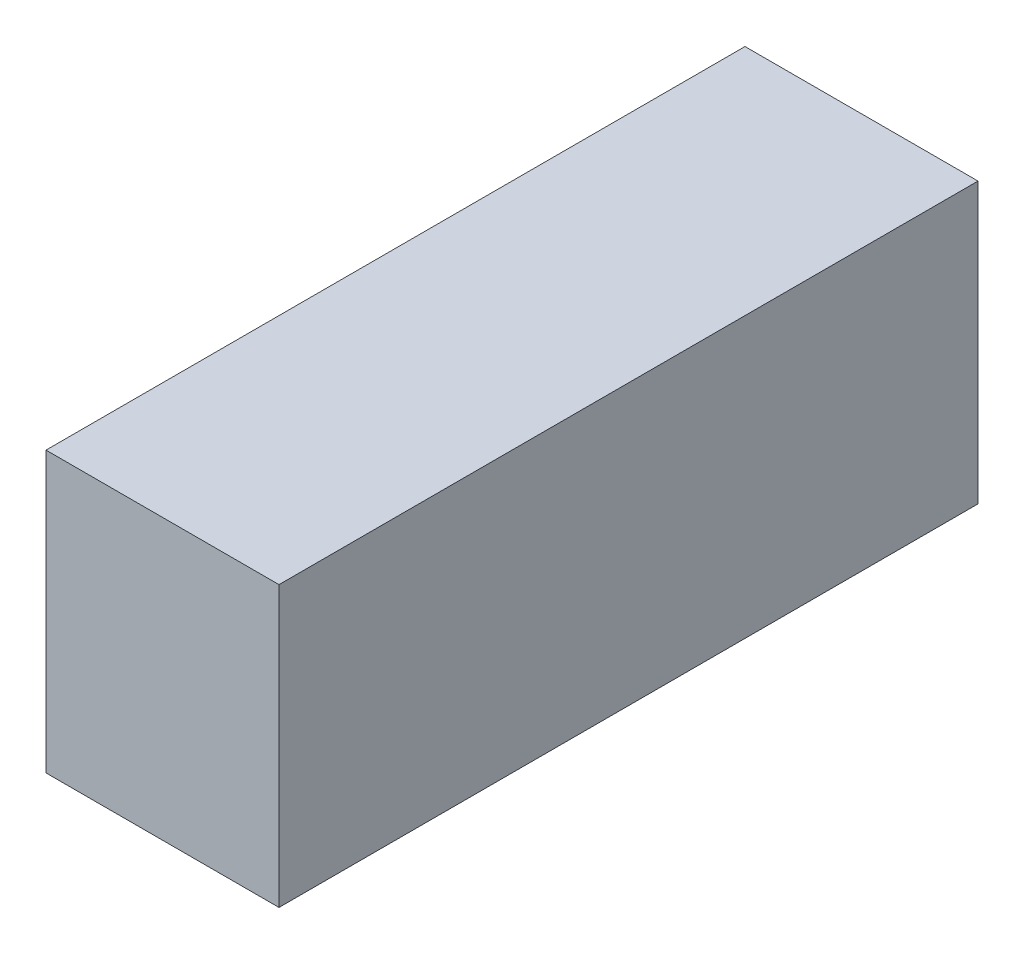
from build123d import *

# Parameters (mm, degrees)
SKETCH_1_W      = 0.5
SKETCH_1_H      = 0.6
EXTRUDE_1_DEPTH = 1.5


with BuildPart() as part:
    # 草图1 → 凸台-拉伸1 (new body)
    with BuildSketch(Plane.XY):
        Rectangle(SKETCH_1_W, SKETCH_1_H)
    extrude(amount=EXTRUDE_1_DEPTH)


solid = part.part
